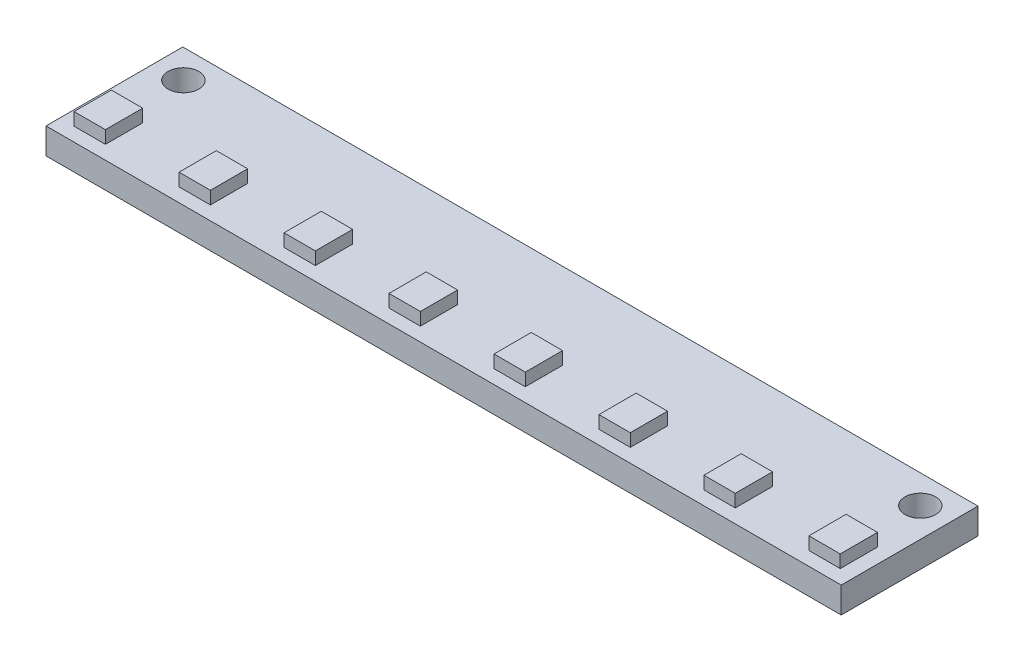
from build123d import *

# Parameters (mm, degrees)
SKETCH4_W           = 75
SKETCH4_H           = 12.9
BOSS_EXTRUDE3_DEPTH = 2.45
SKETCH5_R           = 1.45
CUT_EXTRUDE2_DEPTH  = 2.45
SKETCH6_W           = 2.955726541
SKETCH6_H           = 3.514918049
BOSS_EXTRUDE4_DEPTH = 1.2


with BuildPart() as part:
    # Sketch4 → Boss-Extrude3 (new body)
    with BuildSketch(Plane(origin=(0, 0, 0), x_dir=(1, 0, 0), z_dir=(0, 1, 0))):
        Rectangle(SKETCH4_W, SKETCH4_H)
    extrude(amount=BOSS_EXTRUDE3_DEPTH)

    # Sketch5 → Cut-Extrude2 (cut)
    with BuildSketch(Plane(origin=(0, 2.45, 0), x_dir=(1, 0, 0), z_dir=(0, 1, 0))):
        with Locations(Location((34.75, 3.76, 0), (0, 0, 270))):
            Circle(SKETCH5_R)
        with Locations(Location((-34.75, 3.76, 0), (0, 0, 270))):
            Circle(SKETCH5_R)
    extrude(amount=-CUT_EXTRUDE2_DEPTH, mode=Mode.SUBTRACT)

    # Sketch6 → Boss-Extrude4 (add)
    with BuildSketch(Plane(origin=(0, 2.45, 0), x_dir=(1, 0, 0), z_dir=(0, 1, 0))):
        with Locations((24.729931231, -3.395091298)):
            Rectangle(SKETCH6_W, SKETCH6_H)
        with Locations((34.629931231, -3.395091298)):
            Rectangle(SKETCH6_W, SKETCH6_H)
        with Locations((14.829931231, -3.395091298)):
            Rectangle(SKETCH6_W, SKETCH6_H)
        with Locations((4.929931231, -3.395091298)):
            Rectangle(SKETCH6_W, SKETCH6_H)
        with Locations((-4.97006877, -3.395091298)):
            Rectangle(SKETCH6_W, SKETCH6_H)
        with Locations((-14.87006877, -3.395091298)):
            Rectangle(SKETCH6_W, SKETCH6_H)
        with Locations((-24.770068769, -3.395091298)):
            Rectangle(SKETCH6_W, SKETCH6_H)
        with Locations((-34.67006877, -3.395091298)):
            Rectangle(SKETCH6_W, SKETCH6_H)
    extrude(amount=BOSS_EXTRUDE4_DEPTH)


solid = part.part
